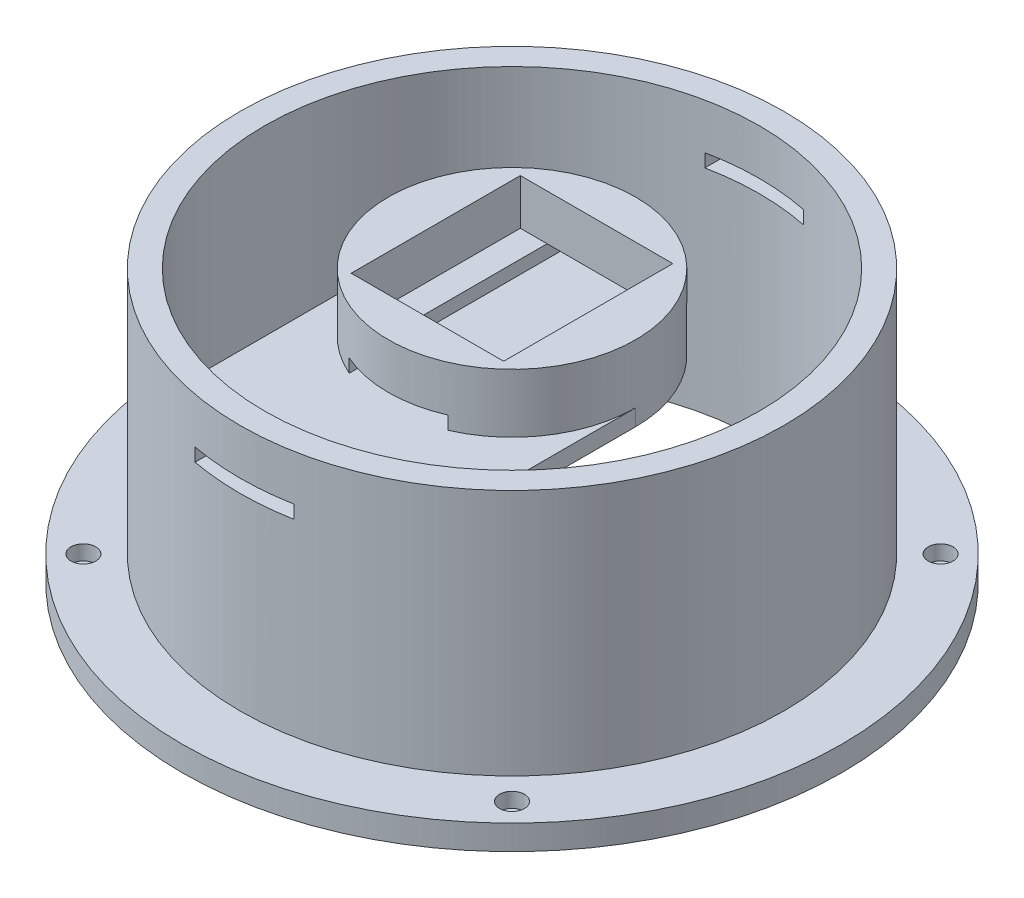
from build123d import *

# Parameters (mm, degrees)
SKETCH_1_R                  = 200
SKETCH_1_R_2                = 150
EXTRUDE_1_DEPTH             = 15
SKETCH_2_R                  = 165
SKETCH_2_R_2                = 150
EXTRUDE_2_DEPTH             = 150
HOLE_WIZARD_M8_1_AT_2_COUNT = 2
HOLE_WIZARD_M8_1_AT_2_PITCH = 260
HOLE_WIZARD_M8_1_AT_3_COUNT = 2
HOLE_WIZARD_M8_1_AT_3_PITCH = 367.695526217
HOLE_WIZARD_M8_1_AT_4_COUNT = 2
HOLE_WIZARD_M8_1_AT_4_PITCH = 260
SKETCH_8_R                  = 75
EXTRUDE_5_DEPTH             = 165
SKETCH_11_W                 = 92.5
SKETCH_11_H                 = 102.616555874
CUT_EXTRUDE_3_DEPTH         = 27.7
SKETCH_12_W                 = 60
SKETCH_12_H                 = 102.616555874
CUT_EXTRUDE_6_DEPTH         = 8
CUT_EXTRUDE_7_DEPTH         = 220
CUT_EXTRUDE_7_DEPTH_BACK    = 165
SKETCH_14_W                 = 60
SKETCH_14_H                 = 8
SKETCH_15_R                 = 75
CUT_EXTRUDE_8_DEPTH         = 119.3
EXTRUDE_6_DEPTH             = 10


with BuildPart() as part:
    # 草图1 → 凸台-拉伸1 (new body)
    with BuildSketch(Plane(origin=(0, 0, 0), x_dir=(1, 0, 0), z_dir=(0, 1, 0))):
        with Locations(Location((0, 0, 0), (0, 0, 270))):
            Circle(SKETCH_1_R)
        with Locations(Location((0, 0, 0), (0, 0, 270))):
            Circle(SKETCH_1_R_2, mode=Mode.SUBTRACT)
    extrude(amount=EXTRUDE_1_DEPTH)

    # 草图2 → 凸台-拉伸2 (add)
    with BuildSketch(Plane(origin=(0, 15, 0), x_dir=(1, 0, 0), z_dir=(0, 1, 0))):
        with Locations(Location((0, 0, 0), (0, 0, 270))):
            Circle(SKETCH_2_R)
        with Locations(Location((0, 0, 0), (0, 0, 270))):
            Circle(SKETCH_2_R_2, mode=Mode.SUBTRACT)
    extrude(amount=EXTRUDE_2_DEPTH)

    # 草图5 → M8 六角圆柱头螺钉的柱形沉头孔1 (revolve, cut)
    with BuildSketch(Plane(origin=(-130, 15, -130), x_dir=(0, 0, 1), z_dir=(1, 0, 0))):
        Polygon((0, 0), (0, 15), (4.2, 15), (4.2, 9), (7.5, 9), (7.5, 0.025), (7.525, 0), align=None)
    hole_wizard_m8_1 = revolve(axis=Axis((-130, 21.35, -130), (0, -1, 0)), mode=Mode.SUBTRACT)

    # M8 六角圆柱头螺钉的柱形沉头孔1 at 2: M8 六角圆柱头螺钉的柱形沉头孔1 ×2
    with Locations(*[(i * HOLE_WIZARD_M8_1_AT_2_PITCH, 0, 0) for i in range(1, HOLE_WIZARD_M8_1_AT_2_COUNT)]):
        add(hole_wizard_m8_1, mode=Mode.SUBTRACT)

    # M8 六角圆柱头螺钉的柱形沉头孔1 at 3: M8 六角圆柱头螺钉的柱形沉头孔1 ×2
    with Locations(*[Vector(0.7071067811865476, 0, 0.7071067811865476) * (i * HOLE_WIZARD_M8_1_AT_3_PITCH) for i in range(1, HOLE_WIZARD_M8_1_AT_3_COUNT)]):
        add(hole_wizard_m8_1, mode=Mode.SUBTRACT)

    # M8 六角圆柱头螺钉的柱形沉头孔1 at 4: M8 六角圆柱头螺钉的柱形沉头孔1 ×2
    with Locations(*[(0, 0, i * HOLE_WIZARD_M8_1_AT_4_PITCH) for i in range(1, HOLE_WIZARD_M8_1_AT_4_COUNT)]):
        add(hole_wizard_m8_1, mode=Mode.SUBTRACT)


with BuildPart() as body_2:
    # 草图8 → 凸台-拉伸5 (new body)
    with BuildSketch(Plane.XZ):
        with Locations(Location((0, 0, 0), (0, 0, 270))):
            Circle(SKETCH_8_R)
    extrude(amount=-EXTRUDE_5_DEPTH)

    # 草图11 → 切除-拉伸3 (cut)
    with BuildSketch(Plane(origin=(0, 165, 0), x_dir=(1, 0, 0), z_dir=(0, 1, 0))):
        Rectangle(SKETCH_11_W, SKETCH_11_H)
    extrude(amount=-CUT_EXTRUDE_3_DEPTH, mode=Mode.SUBTRACT)

    # 草图12 → 切除-拉伸6 (cut)
    with BuildSketch(Plane(origin=(0, 137.3, 0), x_dir=(1, 0, 0), z_dir=(0, 1, 0))):
        Rectangle(SKETCH_12_W, SKETCH_12_H)
    extrude(amount=-CUT_EXTRUDE_6_DEPTH, mode=Mode.SUBTRACT)


with BuildPart() as cut_extrude_7_tool:
    # 草图14 → 切除-拉伸7 (new, two sides: drawn at the far end of the back side and taken through both)
    with BuildSketch(Plane.XY.offset(-51.308277937).offset(-CUT_EXTRUDE_7_DEPTH_BACK)):
        with Locations((0, 133.3)):
            Rectangle(SKETCH_14_W, SKETCH_14_H)
    extrude(amount=CUT_EXTRUDE_7_DEPTH + CUT_EXTRUDE_7_DEPTH_BACK)


with BuildPart() as part_1:
    add(part.part)

    # 切除-拉伸7: cut by cut_extrude_7_tool
    add(cut_extrude_7_tool.part, mode=Mode.SUBTRACT)



with BuildPart() as body_2_1:
    add(body_2.part)

    # 切除-拉伸7: cut by cut_extrude_7_tool
    add(cut_extrude_7_tool.part, mode=Mode.SUBTRACT)

    # 草图15 → 切除-拉伸8 (cut)
    with BuildSketch(Plane.XZ):
        with Locations(Location((0, 0, 0), (0, 0, 270))):
            Circle(SKETCH_15_R)
    extrude(amount=-CUT_EXTRUDE_8_DEPTH, mode=Mode.SUBTRACT)


with BuildPart() as part_2:
    add(part_1.part)

    add(body_2_1.part)  # 凸台-拉伸6 merges body 2
    # 草图16 → 凸台-拉伸6 (add)
    with BuildSketch(Plane.XZ.offset(-119.3)):
        with BuildLine():
            Line((-75, 129.903810568), (-75, 0))
            ThreePointArc((-75, 0), (0, 75), (75, 0))
            Line((75, 0), (75, 129.903810568))
            ThreePointArc((75, 129.903810568), (0, 150), (-75, 129.903810568))
        make_face()
    extrude(amount=-EXTRUDE_6_DEPTH)


solid = part_2.part
